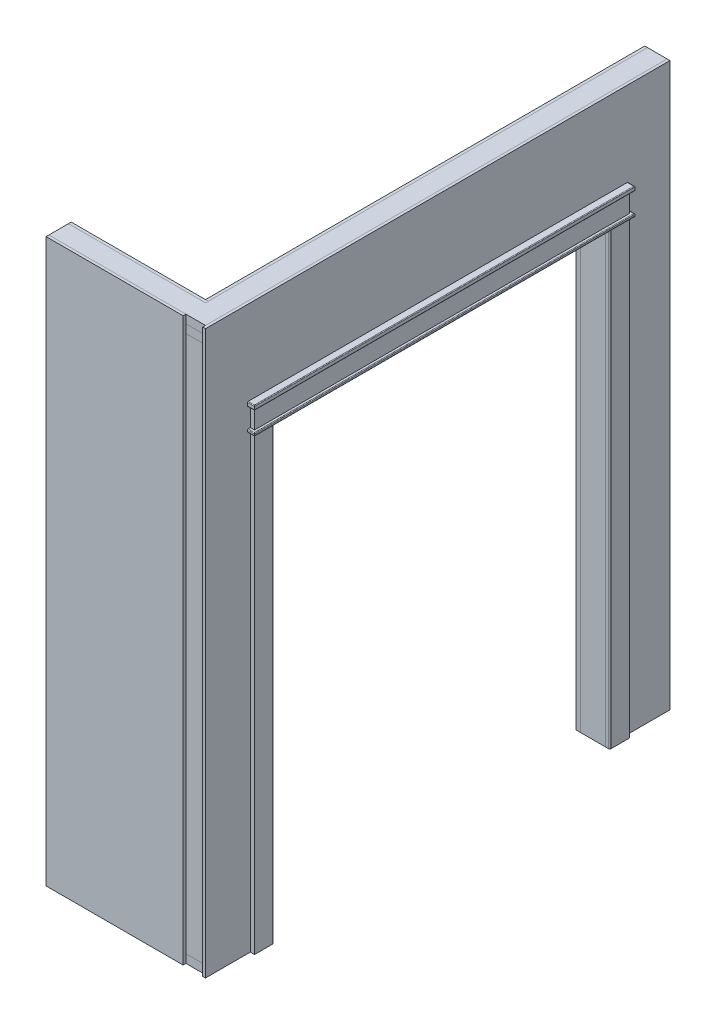
from build123d import *

# Parameters (mm, degrees)
SKETCH2_W                          = 622.3
SKETCH2_H                          = 88.9
SOLE_PLATE_1_DEPTH                 = 38.1
SKETCH3_W                          = 88.9
SKETCH3_H                          = 260.35
SOLE_PLATE_2_DEPTH                 = 38.1
SKETCH3_H_2                        = 273.05
SOLE_PLATE_2_2_DEPTH               = 38.1
SKETCH5_W                          = 88.9
SKETCH5_H                          = 38.1
FRAMING_STUDS_DEPTH                = 2438.4
FRAMING_STUDS_2_DEPTH              = 2438.4
SKETCH5_W_2                        = 38.1
SKETCH5_H_2                        = 88.9
FRAMING_STUDS_3_DEPTH              = 2438.4
FRAMING_STUDS_4_DEPTH              = 2438.4
FRAMING_STUDS_5_DEPTH              = 2438.4
FRAMING_STUDS_6_DEPTH              = 2438.4
FRAMING_STUDS_7_DEPTH              = 2438.4
SKETCH6_W                          = 88.9
SKETCH6_H                          = 38.1
JACK_STUDS_DEPTH                   = 2030.4125
JACK_STUDS_2_DEPTH                 = 2030.4125
SKETCH7_W                          = 88.9
SKETCH7_H                          = 1638.3
HEADER_DEPTH                       = 38.1
SKETCH8_W                          = 88.9
SKETCH8_H                          = 38.1
CRIPPLE_STUDS_DEPTH                = 369.8875
CRIPPLE_STUDS_2_DEPTH              = 369.8875
CRIPPLE_STUDS_3_DEPTH              = 369.8875
CRIPPLE_STUDS_4_DEPTH              = 369.8875
CRIPPLE_STUDS_5_DEPTH              = 369.8875
TOP_PLATE_1_DEPTH                  = 38.1
SKETCH10_W                         = 622.3
SKETCH10_H                         = 2552.7
INSIDE_SIDE_WALL_DRY_WALL_DEPTH    = 12.7
INSIDE_MAIN_WALL_DRY_WALL_DEPTH    = 12.7
SKETCH12_W                         = 622.3
SKETCH12_H                         = 2552.7
OUTSIDE_SIDE_WALL_DRY_WALL_DEPTH   = 12.7
OUTSIDE_MAIN_WALL_DRY_WALL_DEPTH   = 12.7
TOP_PLATE_2_DEPTH                  = 38.1
SKETCH14_W                         = 88.9
SKETCH14_H                         = 2049.4625
CASING_FLAT_DEPTH                  = 19.05
CASING_FLAT_2_DEPTH                = 19.05
SKETCH14_W_2                       = 1701.8
SKETCH14_H_2                       = 88.9
CASING_FLAT_3_DEPTH                = 19.05
SKETCH14_3_W                       = 1727.2
SKETCH14_3_H                       = 12.7
SKETCH14_3_H_2                     = 19.05
CASING_FILLET_DEPTH                = 31.75
FILLET1_R                          = 3.175
FILLET2_R                          = 6.35
SKETCH17_W                         = 114.3
SKETCH17_H                         = 1562.1
TRIM_DOOR_TOP_DEPTH                = 19.05
SKETCH18_W                         = 114.3
SKETCH18_H                         = 2049.4625
TRIM_DOOR_RIGHT_DEPTH              = 19.05
SKETCH19_W                         = 114.3
SKETCH19_H                         = 2049.4625
TRIM_DOOR_LEFT_DEPTH               = 19.05
SKETCH20_W                         = 88.9
SKETCH20_H                         = 2049.4625
CASING_DOOR_INTERIOR_SIDES_DEPTH   = 19.05
CASING_DOOR_INTERIOR_SIDES_2_DEPTH = 19.05
CASING_DOOR_INTERIOR_TOP_DEPTH     = 19.05
SKETCH23_W                         = 38.1
SKETCH23_H                         = 88.9
BOSS_EXTRUDE1_DEPTH                = 2438.4


with BuildPart() as part:
    # Sketch2 → Sole Plate 1 (new body)
    with BuildSketch(Plane(origin=(0, 0, 0), x_dir=(1, 0, 0), z_dir=(0, 1, 0))):
        with Locations((311.15, 1428.75)):
            Rectangle(SKETCH2_W, SKETCH2_H)
    extrude(amount=SOLE_PLATE_1_DEPTH)


with BuildPart() as body_2:
    # Sketch3 → Sole Plate 2 (new body)
    with BuildSketch(Plane(origin=(0, 0, 0), x_dir=(1, 0, 0), z_dir=(0, 1, 0))):
        with Locations((666.75, 1514.475)):
            Rectangle(SKETCH3_W, SKETCH3_H)
    extrude(amount=SOLE_PLATE_2_DEPTH)


with BuildPart() as body_3:
    # Sketch3 → Sole Plate 2 2 (new body)
    with BuildSketch(Plane(origin=(0, 0, 0), x_dir=(1, 0, 0), z_dir=(0, 1, 0))):
        with Locations((666.75, 3343.275)):
            Rectangle(SKETCH3_W, SKETCH3_H_2)
    extrude(amount=SOLE_PLATE_2_2_DEPTH)


with BuildPart() as body_4:
    # Sketch5 → Framing Studs (new body)
    with BuildSketch(Plane(origin=(0, 38.1, 0), x_dir=(1, 0, 0), z_dir=(0, 1, 0))):
        with Locations((666.75, 1403.35)):
            Rectangle(SKETCH5_W, SKETCH5_H)
    extrude(amount=FRAMING_STUDS_DEPTH)


with BuildPart() as body_5:
    # Sketch5 → Framing Studs 2 (new body)
    with BuildSketch(Plane(origin=(0, 38.1, 0), x_dir=(1, 0, 0), z_dir=(0, 1, 0))):
        with Locations((666.75, 1479.55)):
            Rectangle(SKETCH5_W, SKETCH5_H)
    extrude(amount=FRAMING_STUDS_2_DEPTH)


with BuildPart() as body_6:
    # Sketch5 → Framing Studs 3 (new body)
    with BuildSketch(Plane(origin=(0, 38.1, 0), x_dir=(1, 0, 0), z_dir=(0, 1, 0))):
        with Locations((19.05, 1428.75)):
            Rectangle(SKETCH5_W_2, SKETCH5_H_2)
    extrude(amount=FRAMING_STUDS_3_DEPTH)


with BuildPart() as body_7:
    # Sketch5 → Framing Studs 4 (new body)
    with BuildSketch(Plane(origin=(0, 38.1, 0), x_dir=(1, 0, 0), z_dir=(0, 1, 0))):
        with Locations((425.45, 1428.75)):
            Rectangle(SKETCH5_W_2, SKETCH5_H_2)
    extrude(amount=FRAMING_STUDS_4_DEPTH)


with BuildPart() as body_8:
    # Sketch5 → Framing Studs 5 (new body)
    with BuildSketch(Plane(origin=(0, 38.1, 0), x_dir=(1, 0, 0), z_dir=(0, 1, 0))):
        with Locations((666.75, 3460.75)):
            Rectangle(SKETCH5_W, SKETCH5_H)
    extrude(amount=FRAMING_STUDS_5_DEPTH)


with BuildPart() as body_9:
    # Sketch5 → Framing Studs 6 (new body)
    with BuildSketch(Plane(origin=(0, 38.1, 0), x_dir=(1, 0, 0), z_dir=(0, 1, 0))):
        with Locations((666.75, 1587.5)):
            Rectangle(SKETCH5_W, SKETCH5_H)
    extrude(amount=FRAMING_STUDS_6_DEPTH)


with BuildPart() as body_10:
    # Sketch5 → Framing Studs 7 (new body)
    with BuildSketch(Plane(origin=(0, 38.1, 0), x_dir=(1, 0, 0), z_dir=(0, 1, 0))):
        with Locations((666.75, 3263.9)):
            Rectangle(SKETCH5_W, SKETCH5_H)
    extrude(amount=FRAMING_STUDS_7_DEPTH)


with BuildPart() as body_11:
    # Sketch6 → Jack Studs (new body)
    with BuildSketch(Plane(origin=(0, 38.1, 0), x_dir=(1, 0, 0), z_dir=(0, 1, 0))):
        with Locations((666.75, 3225.8)):
            Rectangle(SKETCH6_W, SKETCH6_H)
    extrude(amount=JACK_STUDS_DEPTH)


with BuildPart() as body_12:
    # Sketch6 → Jack Studs 2 (new body)
    with BuildSketch(Plane(origin=(0, 38.1, 0), x_dir=(1, 0, 0), z_dir=(0, 1, 0))):
        with Locations((666.75, 1625.6)):
            Rectangle(SKETCH6_W, SKETCH6_H)
    extrude(amount=JACK_STUDS_2_DEPTH)


with BuildPart() as body_13:
    # Sketch7 → Header (new body)
    with BuildSketch(Plane(origin=(0, 2068.5125, 0), x_dir=(1, 0, 0), z_dir=(0, 1, 0))):
        with Locations((666.75, 2425.7)):
            Rectangle(SKETCH7_W, SKETCH7_H)
    extrude(amount=HEADER_DEPTH)


with BuildPart() as body_14:
    # Sketch8 → Cripple Studs (new body)
    with BuildSketch(Plane(origin=(0, 2106.6125, 0), x_dir=(1, 0, 0), z_dir=(0, 1, 0))):
        with Locations((666.75, 1625.6)):
            Rectangle(SKETCH8_W, SKETCH8_H)
    extrude(amount=CRIPPLE_STUDS_DEPTH)


with BuildPart() as body_15:
    # Sketch8 → Cripple Studs 2 (new body)
    with BuildSketch(Plane(origin=(0, 2106.6125, 0), x_dir=(1, 0, 0), z_dir=(0, 1, 0))):
        with Locations((666.75, 2032)):
            Rectangle(SKETCH8_W, SKETCH8_H)
    extrude(amount=CRIPPLE_STUDS_2_DEPTH)


with BuildPart() as body_16:
    # Sketch8 → Cripple Studs 3 (new body)
    with BuildSketch(Plane(origin=(0, 2106.6125, 0), x_dir=(1, 0, 0), z_dir=(0, 1, 0))):
        with Locations((666.75, 3225.8)):
            Rectangle(SKETCH8_W, SKETCH8_H)
    extrude(amount=CRIPPLE_STUDS_3_DEPTH)


with BuildPart() as body_17:
    # Sketch8 → Cripple Studs 4 (new body)
    with BuildSketch(Plane(origin=(0, 2106.6125, 0), x_dir=(1, 0, 0), z_dir=(0, 1, 0))):
        with Locations((666.75, 2438.4)):
            Rectangle(SKETCH8_W, SKETCH8_H)
    extrude(amount=CRIPPLE_STUDS_4_DEPTH)


with BuildPart() as body_18:
    # Sketch8 → Cripple Studs 5 (new body)
    with BuildSketch(Plane(origin=(0, 2106.6125, 0), x_dir=(1, 0, 0), z_dir=(0, 1, 0))):
        with Locations((666.75, 2844.8)):
            Rectangle(SKETCH8_W, SKETCH8_H)
    extrude(amount=CRIPPLE_STUDS_5_DEPTH)


with BuildPart() as body_19:
    # Sketch9 → Top Plate 1 (new body)
    with BuildSketch(Plane(origin=(0, 2476.5, 0), x_dir=(1, 0, 0), z_dir=(0, 1, 0))):
        Polygon((0, 1384.3), (711.2, 1384.3), (711.2, 3479.8), (622.3, 3479.8), (622.3, 1473.2), (0, 1473.2), align=None)
    extrude(amount=TOP_PLATE_1_DEPTH)


with BuildPart() as body_20:
    # Sketch10 → Inside Side Wall Dry Wall (new body)
    with BuildSketch(Plane(origin=(0, 0, -1473.2), x_dir=(-1, 0, 0), z_dir=(0, 0, -1))):
        with Locations((-311.15, 1276.35)):
            Rectangle(SKETCH10_W, SKETCH10_H)
    extrude(amount=INSIDE_SIDE_WALL_DRY_WALL_DEPTH)


with BuildPart() as body_21:
    # Sketch11 → Inside Main Wall Dry Wall (new body)
    with BuildSketch(Plane.ZY.offset(-622.300000001)):
        Polygon((-1485.9, 0), (-1485.9, 2552.7), (-3479.8, 2552.7), (-3479.8, 0), (-3206.75, 0), (-3206.75, 2068.5125), (-1644.65, 2068.5125), (-1644.65, 0), align=None)
    extrude(amount=INSIDE_MAIN_WALL_DRY_WALL_DEPTH)


with BuildPart() as body_22:
    # Sketch12 → Outside Side Wall Dry Wall (new body)
    with BuildSketch(Plane.XY.offset(-1384.3)):
        with Locations((311.15, 1276.35)):
            Rectangle(SKETCH12_W, SKETCH12_H)
    extrude(amount=OUTSIDE_SIDE_WALL_DRY_WALL_DEPTH)


with BuildPart() as body_23:
    # Sketch13 → Outside Main Wall Dry Wall (new body)
    with BuildSketch(Plane(origin=(711.2, 0, 0), x_dir=(0, 0, -1), z_dir=(1, 0, 0))):
        Polygon((3479.8, 0), (3206.75, 0), (3206.75, 2068.5125), (1644.65, 2068.5125), (1644.65, 0), (1371.6, 0), (1371.6, 2552.7), (3479.8, 2552.7), align=None)
    extrude(amount=OUTSIDE_MAIN_WALL_DRY_WALL_DEPTH)



with BuildPart() as body_24:
    # Sketch21 → Top Plate 2 (new body)
    with BuildSketch(Plane(origin=(0, 2514.6, 0), x_dir=(1, 0, 0), z_dir=(0, 1, 0))):
        Polygon((622.3, 3479.8), (622.3, 1473.2), (0, 1473.2), (0, 1384.3), (711.2, 1384.3), (711.2, 3479.8), align=None)
    extrude(amount=TOP_PLATE_2_DEPTH)


with BuildPart() as body_25:
    # Sketch14 → Casing Flat (new body)
    with BuildSketch(Plane(origin=(723.9, 0, 0), x_dir=(0, 0, -1), z_dir=(1, 0, 0))):
        with Locations((1619.25, 1024.73125)):
            Rectangle(SKETCH14_W, SKETCH14_H)
    extrude(amount=CASING_FLAT_DEPTH)


with BuildPart() as body_26:
    # Sketch14 → Casing Flat 2 (new body)
    with BuildSketch(Plane(origin=(723.9, 0, 0), x_dir=(0, 0, -1), z_dir=(1, 0, 0))):
        with Locations((3232.15, 1024.73125)):
            Rectangle(SKETCH14_W, SKETCH14_H)
    extrude(amount=CASING_FLAT_2_DEPTH)


with BuildPart() as body_27:
    # Sketch14 → Casing Flat 3 (new body)
    with BuildSketch(Plane(origin=(723.9, 0, 0), x_dir=(0, 0, -1), z_dir=(1, 0, 0))):
        with Locations((2425.7, 2106.6125)):
            Rectangle(SKETCH14_W_2, SKETCH14_H_2)
    extrude(amount=CASING_FLAT_3_DEPTH)


with BuildPart() as body_23_1:
    add(body_23.part)

    add(body_25.part)  # Casing Fillet merges body 25

    add(body_26.part)  # Casing Fillet merges body 26

    add(body_27.part)  # Casing Fillet merges body 27
    # Sketch14<3> → Casing Fillet (add)
    with BuildSketch(Plane(origin=(723.9, 0, 0), x_dir=(0, 0, -1), z_dir=(1, 0, 0))):
        with Locations((2425.7, 2055.8125)):
            Rectangle(SKETCH14_3_W, SKETCH14_3_H)
        with Locations((2425.7, 2160.5875)):
            Rectangle(SKETCH14_3_W, SKETCH14_3_H_2)
    extrude(amount=CASING_FILLET_DEPTH)

    # Fillet1
    fillet1_edges = [body_23_1.edges().sort_by_distance(p)[0] for p in [
        (739.775, 2151.0625, -3289.3),
        (755.65, 2170.1125, -2425.7),
        (739.775, 2170.1125, -3289.3),
        (739.775, 2170.1125, -1562.1),
        (739.775, 2151.0625, -1562.1),
        (755.65, 2151.0625, -2425.7),
        (755.65, 2062.1625, -2425.7),
        (739.775, 2062.1625, -3289.3),
        (755.65, 2049.4625, -2425.7),
        (739.775, 2049.4625, -1562.1),
        (739.775, 2049.4625, -3289.3),
        (739.775, 2062.1625, -1562.1),
    ]]
    fillet(fillet1_edges, radius=FILLET1_R)

    # Fillet2
    fillet2_edges = [body_23_1.edges().sort_by_distance(p)[0] for p in [
        (742.95, 1024.73125, -1663.7),
        (742.95, 1024.73125, -3187.7),
    ]]
    fillet(fillet2_edges, radius=FILLET2_R)


with BuildPart() as body_25_2:
    # Sketch17 → Trim Door Top (new body)
    with BuildSketch(Plane(origin=(0, 2068.5125, 0), x_dir=(-1, 0, 0), z_dir=(0, -1, 0))):
        with Locations((-666.75, 2425.7)):
            Rectangle(SKETCH17_W, SKETCH17_H)
    extrude(amount=TRIM_DOOR_TOP_DEPTH)


with BuildPart() as body_26_2:
    # Sketch18 → Trim Door Right (new body)
    with BuildSketch(Plane.XY.offset(-3206.75)):
        with Locations((666.75, 1024.73125)):
            Rectangle(SKETCH18_W, SKETCH18_H)
    extrude(amount=TRIM_DOOR_RIGHT_DEPTH)


with BuildPart() as body_27_2:
    # Sketch19 → Trim Door Left (new body)
    with BuildSketch(Plane(origin=(0, 0, -1644.65), x_dir=(-1, 0, 0), z_dir=(0, 0, -1))):
        with Locations((-666.75, 1024.73125)):
            Rectangle(SKETCH19_W, SKETCH19_H)
    extrude(amount=TRIM_DOOR_LEFT_DEPTH)


with BuildPart() as body_28:
    # Sketch20 → Casing Door interior Sides (new body)
    with BuildSketch(Plane.ZY.offset(-609.600000001)):
        with Locations((-1619.25, 1024.73125)):
            Rectangle(SKETCH20_W, SKETCH20_H)
    extrude(amount=CASING_DOOR_INTERIOR_SIDES_DEPTH)


with BuildPart() as body_29:
    # Sketch20 → Casing Door interior Sides 2 (new body)
    with BuildSketch(Plane.ZY.offset(-609.600000001)):
        with Locations((-3232.15, 1024.73125)):
            Rectangle(SKETCH20_W, SKETCH20_H)
    extrude(amount=CASING_DOOR_INTERIOR_SIDES_2_DEPTH)


with BuildPart() as body_30:
    # Sketch20<4> → Casing Door Interior Top (new body)
    with BuildSketch(Plane.ZY.offset(-609.600000001)):
        Polygon((-1644.65, 2068.5125), (-1644.65, 2049.4625), (-1574.8, 2049.4625), (-1574.8, 2138.3625), (-3276.6, 2138.3625), (-3276.6, 2049.4625), (-3206.75, 2049.4625), (-3206.75, 2068.5125), align=None)
        Polygon((-3187.7, 2049.4625), (-1663.7, 2049.4625), (-1644.65, 2049.4625), (-1644.65, 2068.5125), (-3206.75, 2068.5125), (-3206.75, 2049.4625), align=None)
    extrude(amount=CASING_DOOR_INTERIOR_TOP_DEPTH)


with BuildPart() as body_31:
    # Sketch23 → Boss-Extrude1 (new body)
    with BuildSketch(Plane(origin=(0, 38.1, 0), x_dir=(1, 0, 0), z_dir=(0, 1, 0))):
        with Locations((603.25, 1428.75)):
            Rectangle(SKETCH23_W, SKETCH23_H)
    extrude(amount=BOSS_EXTRUDE1_DEPTH)


solid = Compound([part.part, body_2.part, body_3.part, body_4.part, body_5.part, body_6.part, body_7.part, body_8.part, body_9.part, body_10.part, body_11.part, body_12.part, body_13.part, body_14.part, body_15.part, body_16.part, body_17.part, body_18.part, body_19.part, body_20.part, body_21.part, body_22.part, body_24.part, body_23_1.part, body_25_2.part, body_26_2.part, body_27_2.part, body_28.part, body_29.part, body_30.part, body_31.part])
